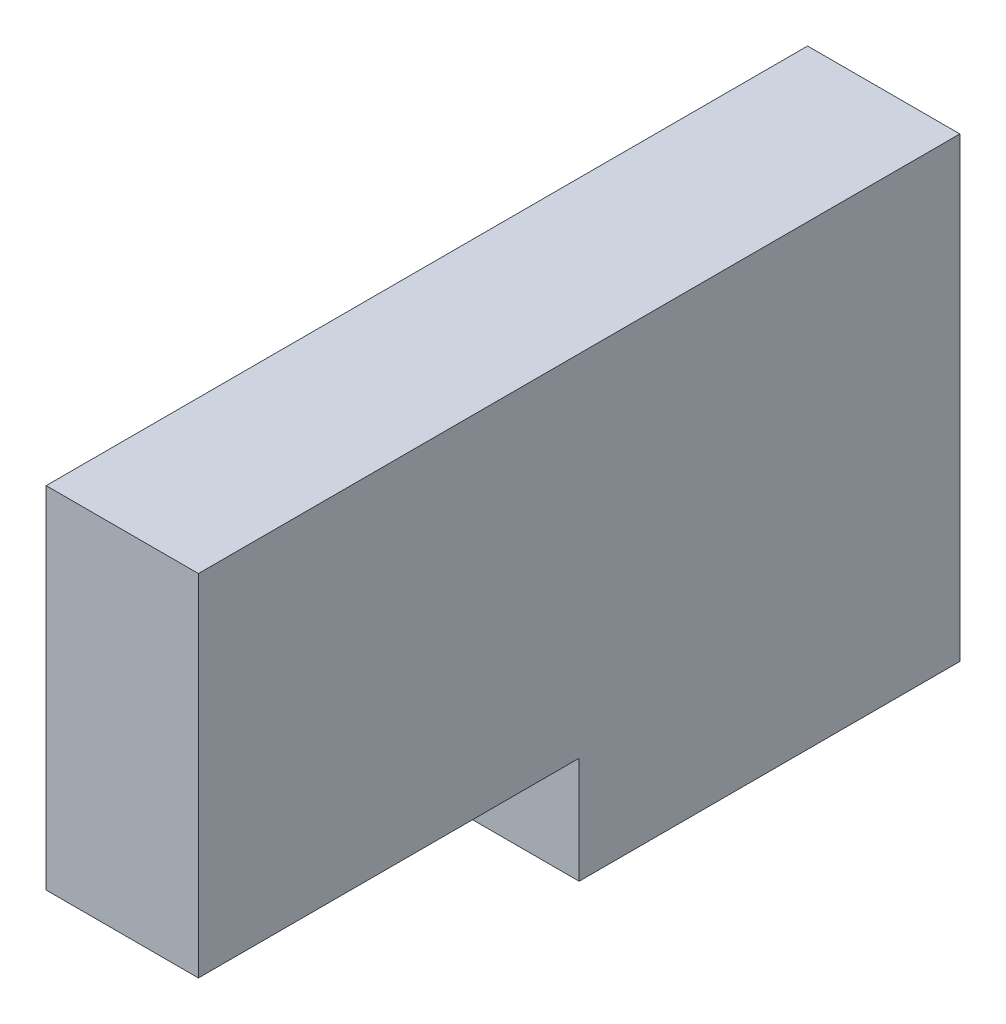
from build123d import *

# Parameters (mm, degrees)
ESQUISSE1_W             = 10
ESQUISSE1_H             = 30
ESQUISSE1_R             = 1.75
BOSS_EXTRU_1_DEPTH      = 20
ESQUISSE2_W             = 10
ESQUISSE2_H             = 30
BOSS_EXTRU_2_DEPTH      = 5
ESQUISSE3_W             = 10
ESQUISSE3_H             = 23
BOSS_EXTRU_3_DEPTH      = 25
ESQUISSE4_R             = 1.75
ENL_V_MAT_EXTRU_1_DEPTH = 15


with BuildPart() as part:
    # Esquisse1 → Boss.-Extru.1 (new body)
    with BuildSketch(Plane.XY):
        with Locations((5, 15)):
            Rectangle(ESQUISSE1_W, ESQUISSE1_H)
        with Locations((5, 5)):
            Circle(ESQUISSE1_R, mode=Mode.SUBTRACT)
        with Locations((5, 15)):
            Circle(ESQUISSE1_R, mode=Mode.SUBTRACT)
        with Locations((5, 25)):
            Circle(ESQUISSE1_R, mode=Mode.SUBTRACT)
    extrude(amount=BOSS_EXTRU_1_DEPTH)

    # Esquisse2 → Boss.-Extru.2 (add)
    with BuildSketch(Plane.XY.offset(20)):
        with Locations((5, 15)):
            Rectangle(ESQUISSE2_W, ESQUISSE2_H)
    extrude(amount=BOSS_EXTRU_2_DEPTH)

    # Esquisse3 → Boss.-Extru.3 (add)
    with BuildSketch(Plane.XY.offset(25)):
        with Locations((5, 18.5)):
            Rectangle(ESQUISSE3_W, ESQUISSE3_H)
    extrude(amount=BOSS_EXTRU_3_DEPTH)

    # Esquisse4 → Enlèv. mat.-Extru.1 (cut)
    with BuildSketch(Plane(origin=(0, 7, 0), x_dir=(-1, 0, 0), z_dir=(0, -1, 0))):
        with Locations(Location((-5, -45, 0), (0, 0, 180))):
            Circle(ESQUISSE4_R)
        with Locations(Location((-5, -35, 0), (0, 0, 180))):
            Circle(ESQUISSE4_R)
    extrude(amount=-ENL_V_MAT_EXTRU_1_DEPTH, mode=Mode.SUBTRACT)


solid = part.part
